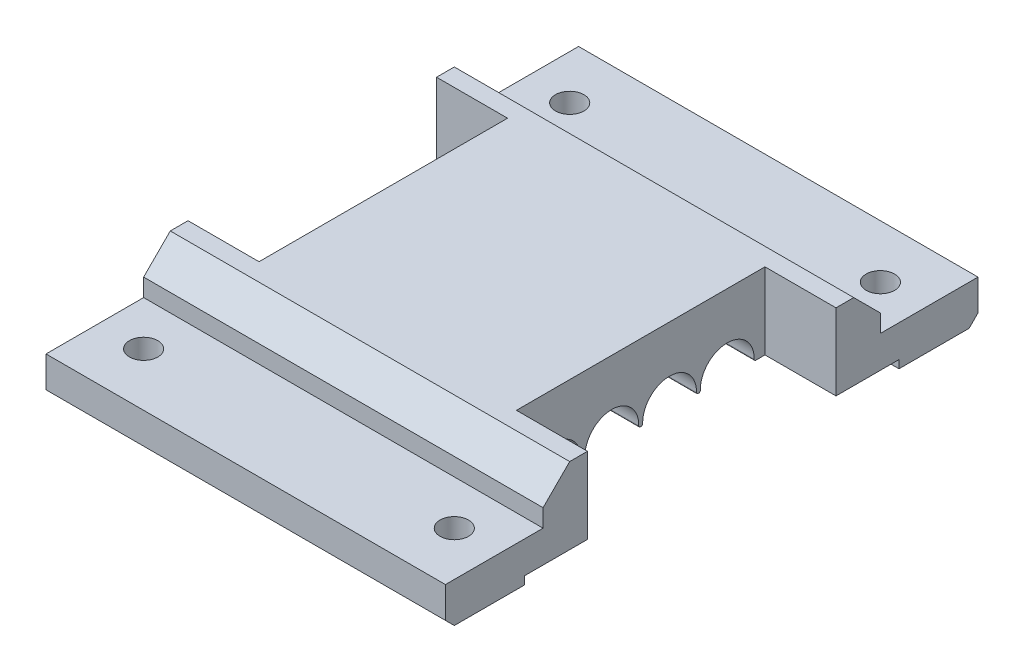
from build123d import *

# Parameters (mm, degrees)
SKETCH1_W                = 45
SKETCH1_H                = 60
SKETCH1_R                = 1.6
BOSS_EXTRUDE1_DEPTH      = 4.5
CHAMFER1_SIZE            = 1
CUT_EXTRUDE1_DEPTH       = 38.769034936
CUT_EXTRUDE1_DEPTH_BACK  = 38.769034936
SKETCH2_W                = 42.2
SKETCH2_H                = 1.8
BOSS_EXTRUDE2_DEPTH      = 22.5
BOSS_EXTRUDE2_DEPTH_BACK = 22.5
CUT_EXTRUDE2_DEPTH       = 39.684622268
CUT_EXTRUDE2_DEPTH_BACK  = 39.684622268
SKETCH6_W                = 16.662256764
SKETCH6_H                = 27.999999992
SKETCH6_W_2              = 12.602721676
CUT_EXTRUDE3_DEPTH       = 10


with BuildPart() as part:
    # Sketch1 → Boss-Extrude1 (new body)
    with BuildSketch(Plane(origin=(0, 0, 0), x_dir=(1, 0, 0), z_dir=(0, 1, 0))):
        Rectangle(SKETCH1_W, SKETCH1_H)
        with Locations(Location((17.5, 24, 0), (0, 0, 270))):
            Circle(SKETCH1_R, mode=Mode.SUBTRACT)
        with Locations(Location((-17.5, 24, 0), (0, 0, 90))):
            Circle(SKETCH1_R, mode=Mode.SUBTRACT)
        with Locations(Location((-17.5, -24, 0), (0, 0, 270))):
            Circle(SKETCH1_R, mode=Mode.SUBTRACT)
        with Locations(Location((17.5, -24, 0), (0, 0, 90))):
            Circle(SKETCH1_R, mode=Mode.SUBTRACT)
    extrude(amount=BOSS_EXTRUDE1_DEPTH)

    # Chamfer1
    chamfer1_edges = [part.edges().sort_by_distance(p)[0] for p in [
        (0, 0, 30),
        (0, 0, -30),
    ]]
    chamfer(chamfer1_edges, length=CHAMFER1_SIZE)

    # Sketch2 → Cut-Extrude1 (cut, two sides: drawn at the far end of the back side and taken through both)
    with BuildSketch(Plane(origin=(0, 0, 0), x_dir=(0, 0, -1), z_dir=(1, 0, 0)).offset(-CUT_EXTRUDE1_DEPTH_BACK)):
        Rectangle(SKETCH2_W, SKETCH2_H)
    extrude(amount=CUT_EXTRUDE1_DEPTH + CUT_EXTRUDE1_DEPTH_BACK, mode=Mode.SUBTRACT)

    # Sketch4 → Boss-Extrude2 (add, two sides: drawn at the far end of the back side and taken through both)
    with BuildSketch(Plane(origin=(0, 0, 0), x_dir=(0, 0, -1), z_dir=(1, 0, 0)).offset(-BOSS_EXTRUDE2_DEPTH_BACK)):
        Polygon((19, 4.5), (-19, 4.5), (-19, 6.5), (-16, 9.5), (16, 9.5), (19, 6.5), align=None)
    extrude(amount=BOSS_EXTRUDE2_DEPTH + BOSS_EXTRUDE2_DEPTH_BACK)

    # Sketch5 → Cut-Extrude2 (cut, two sides: drawn at the far end of the back side and taken through both)
    with BuildSketch(Plane(origin=(0, 0, 0), x_dir=(0, 0, -1), z_dir=(1, 0, 0)).offset(-CUT_EXTRUDE2_DEPTH_BACK)):
        with BuildLine():
            Line((-0.021267592, 0.9), (0.021267592, 0.9))
            ThreePointArc((0.021267592, 0.9), (0.164249511, 0.960439924), (0.22092951, 1.10495356))
            ThreePointArc((0.22092951, 1.10495356), (3.25, 4.21), (6.27907049, 1.10495356))
            ThreePointArc((6.27907049, 1.10495356), (6.335847144, 0.960340972), (6.479009136, 0.9))
            Line((6.479009136, 0.9), (6.520990864, 0.9))
            ThreePointArc((6.520990864, 0.9), (6.664152856, 0.960340972), (6.72092951, 1.10495356))
            ThreePointArc((6.72092951, 1.10495356), (9.75, 4.21), (12.77907049, 1.10495356))
            ThreePointArc((12.77907049, 1.10495356), (12.835847144, 0.960340972), (12.979009136, 0.9))
            Line((12.979009136, 0.9), (11.734788972, -2.913913916))
            Line((11.734788972, -2.913913916), (-11.720609732, -4.129919609))
            Line((-11.720609732, -4.129919609), (-12.979009136, 0.9))
            ThreePointArc((-12.979009136, 0.9), (-12.835847144, 0.960340972), (-12.77907049, 1.10495356))
            ThreePointArc((-12.77907049, 1.10495356), (-9.75, 4.21), (-6.72092951, 1.10495356))
            ThreePointArc((-6.72092951, 1.10495356), (-6.664152856, 0.960340972), (-6.520990864, 0.9))
            Line((-6.520990864, 0.9), (-6.479009136, 0.9))
            ThreePointArc((-6.479009136, 0.9), (-6.335847144, 0.960340972), (-6.27907049, 1.10495356))
            ThreePointArc((-6.27907049, 1.10495356), (-3.25, 4.21), (-0.22092951, 1.10495356))
            ThreePointArc((-0.22092951, 1.10495356), (-0.164249511, 0.960439924), (-0.021267592, 0.9))
        make_face()
    extrude(amount=CUT_EXTRUDE2_DEPTH + CUT_EXTRUDE2_DEPTH_BACK, mode=Mode.SUBTRACT)

    # Sketch6 → Cut-Extrude3 (cut)
    with BuildSketch(Plane(origin=(0, 9.5, 0), x_dir=(1, 0, 0), z_dir=(0, 1, 0))):
        with Locations((-22.831128379, 0)):
            Rectangle(SKETCH6_W, SKETCH6_H)
        with Locations((20.801360835, 0)):
            Rectangle(SKETCH6_W_2, SKETCH6_H)
    extrude(amount=-CUT_EXTRUDE3_DEPTH, mode=Mode.SUBTRACT)


solid = part.part
